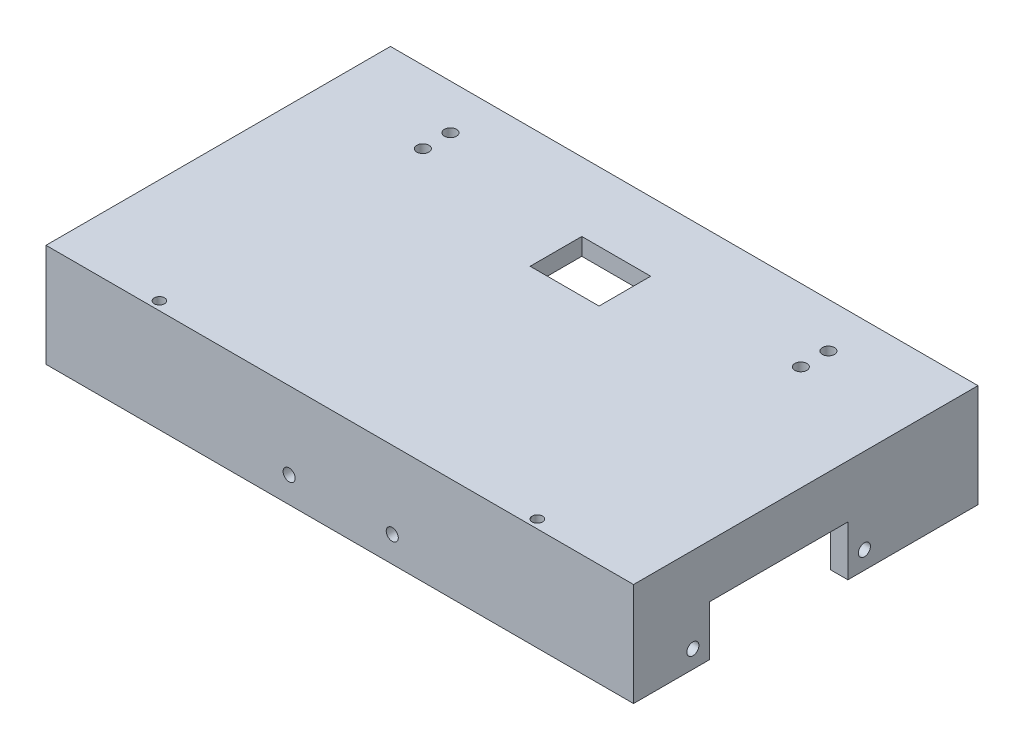
from build123d import *

# Parameters (mm, degrees)
SKETCH3_W           = 170.58
SKETCH3_H           = 100
BOSS_EXTRUDE1_DEPTH = 5
SKETCH4_W           = 5
SKETCH4_H           = 100
BOSS_EXTRUDE2_DEPTH = 24.94
SKETCH6_W           = 160.58
SKETCH6_H           = 5
BOSS_EXTRUDE3_DEPTH = 24.94
BOSS_EXTRUDE4_DEPTH = 24.94
SKETCH8_R           = 1.75
CUT_EXTRUDE1_DEPTH  = 8
SKETCH9_W           = 7.75
SKETCH9_H           = 6.74
CUT_EXTRUDE2_DEPTH  = 10
CUT_EXTRUDE3_DEPTH  = 10
SKETCH11_R          = 1.75
CUT_EXTRUDE4_DEPTH  = 10
SKETCH13_W          = 40.2
SKETCH13_H          = 14.565
CUT_EXTRUDE6_DEPTH  = 200
SKETCH14_R          = 1.75
CUT_EXTRUDE7_DEPTH  = 200
SKETCH15_R          = 1.5
CUT_EXTRUDE8_DEPTH  = 10
SKETCH16_R          = 1.75
CUT_EXTRUDE9_DEPTH  = 10


with BuildPart() as part:
    # Sketch3 → Boss-Extrude1 (new body)
    with BuildSketch(Plane(origin=(0, 0, 0), x_dir=(1, 0, 0), z_dir=(0, 1, 0))):
        with Locations((6.45008576, -36.464595487)):
            Rectangle(SKETCH3_W, SKETCH3_H)
    extrude(amount=BOSS_EXTRUDE1_DEPTH)

    # Sketch4 → Boss-Extrude2 (add)
    with BuildSketch(Plane(origin=(0, 5, 0), x_dir=(1, 0, 0), z_dir=(0, 1, 0))):
        with Locations((89.24008576, -36.464595487)):
            Rectangle(SKETCH4_W, SKETCH4_H)
        with Locations((-76.33991424, -36.464595487)):
            Rectangle(SKETCH4_W, SKETCH4_H)
    extrude(amount=BOSS_EXTRUDE2_DEPTH)

    # Sketch6 → Boss-Extrude3 (add)
    with BuildSketch(Plane(origin=(0, 5, 0), x_dir=(1, 0, 0), z_dir=(0, 1, 0))):
        with Locations((6.45008576, -83.964595487)):
            Rectangle(SKETCH6_W, SKETCH6_H)
    extrude(amount=BOSS_EXTRUDE3_DEPTH)

    # Sketch7 → Boss-Extrude4 (add)
    with BuildSketch(Plane(origin=(0, 5, 0), x_dir=(1, 0, 0), z_dir=(0, 1, 0))):
        Polygon((6.45008576, 13.535404513), (2.715085759, 13.535404513), (2.715085759, 8.535404513), (10.715085759, 8.535404513), (10.715085759, 13.535404513), align=None)
    extrude(amount=BOSS_EXTRUDE4_DEPTH)

    # Sketch8 → Cut-Extrude1 (cut)
    with BuildSketch(Plane.XY.offset(-8.535404513)):
        with Locations((6.715085759, 11.235)):
            Circle(SKETCH8_R)
        with Locations((6.715085759, 23.705)):
            Circle(SKETCH8_R)
    extrude(amount=-CUT_EXTRUDE1_DEPTH, mode=Mode.SUBTRACT)

    # Sketch9 → Cut-Extrude2 (cut)
    with BuildSketch(Plane.ZY.offset(78.83991424)):
        with Locations((-9.660404513, 26.57)):
            Rectangle(SKETCH9_W, SKETCH9_H)
    extrude(amount=-CUT_EXTRUDE2_DEPTH, mode=Mode.SUBTRACT)


with BuildPart() as body_2:
    # Mirror1: mirrored copy
    add(part.part.mirror(Plane(origin=(0, 29.94, 0), x_dir=(0, 0, 1), z_dir=(0, -1, 0))))

    # Sketch10 → Cut-Extrude3 (cut)
    with BuildSketch(Plane(origin=(0, 59.88, 0), x_dir=(1, 0, 0), z_dir=(0, 1, 0))):
        Polygon((16.71508576, -6.464595487), (6.45008576, -6.464595487), (-3.28491424, -6.464595487), (-3.28491424, -21.464595487), (16.71508576, -21.464595487), align=None)
    extrude(amount=-CUT_EXTRUDE3_DEPTH, mode=Mode.SUBTRACT)

    # Sketch11 → Cut-Extrude4 (cut)
    with BuildSketch(Plane(origin=(0, 59.88, 0), x_dir=(1, 0, 0), z_dir=(0, 1, 0))):
        with Locations(Location((-48.41990951, 0.535400876, 0), (0, 0, 270))):
            Circle(SKETCH11_R)
        with Locations(Location((-48.41990951, -7.464599124, 0), (0, 0, 270))):
            Circle(SKETCH11_R)
        with Locations(Location((61.31009049, -7.464599124, 0), (0, 0, 270))):
            Circle(SKETCH11_R)
        with Locations(Location((61.31009049, 0.535400876, 0), (0, 0, 270))):
            Circle(SKETCH11_R)
    extrude(amount=-CUT_EXTRUDE4_DEPTH, mode=Mode.SUBTRACT)

    # Sketch13 → Cut-Extrude6 (cut)
    with BuildSketch(Plane.ZY.offset(78.83991424)):
        with Locations((44.339595487, 37.2225)):
            Rectangle(SKETCH13_W, SKETCH13_H)
    extrude(amount=-CUT_EXTRUDE6_DEPTH, mode=Mode.SUBTRACT)

    # Sketch14 → Cut-Extrude7 (cut)
    with BuildSketch(Plane.ZY.offset(78.83991424)):
        with Locations((19.43959554, 35.1)):
            Circle(SKETCH14_R)
        with Locations((69.23959554, 35.1)):
            Circle(SKETCH14_R)
    extrude(amount=-CUT_EXTRUDE7_DEPTH, mode=Mode.SUBTRACT)

    # Sketch15 → Cut-Extrude8 (cut)
    with BuildSketch(Plane(origin=(0, 59.88, 0), x_dir=(1, 0, 0), z_dir=(0, 1, 0))):
        with Locations(Location((61.31009049, -83.964595487, 0), (0, 0, 270))):
            Circle(SKETCH15_R)
        with Locations(Location((-48.41990951, -83.964595487, 0), (0, 0, 270))):
            Circle(SKETCH15_R)
    extrude(amount=-CUT_EXTRUDE8_DEPTH, mode=Mode.SUBTRACT)

    # Sketch16 → Cut-Extrude9 (cut)
    with BuildSketch(Plane.XY.offset(86.464595487)):
        with Locations((21.687920531, 37.44)):
            Circle(SKETCH16_R)
        with Locations((-8.252079469, 37.44)):
            Circle(SKETCH16_R)
    extrude(amount=-CUT_EXTRUDE9_DEPTH, mode=Mode.SUBTRACT)


solid = body_2.part
